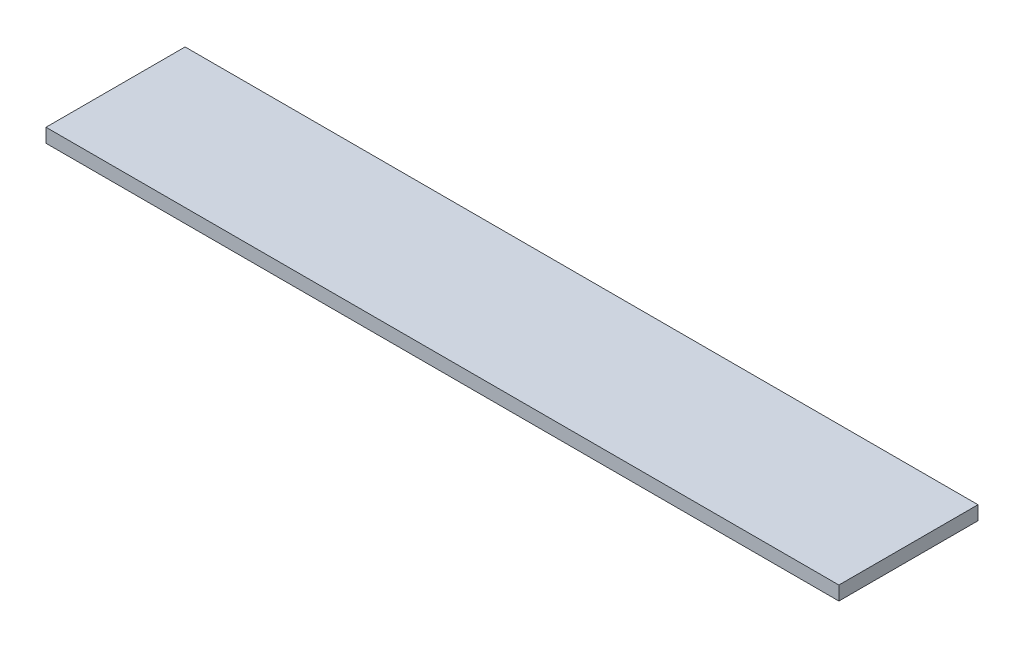
from build123d import *

# Parameters (mm, degrees)
SKETCH1_W             = 57
SKETCH1_H             = 10
BOSS_EXTRUDE1_DEPTH   = 1
BODY_MOVE_COPY1_ANGLE = 90


with BuildPart() as part:
    # Sketch1 → Boss-Extrude1 (new body)
    with BuildSketch(Plane.XY):
        with Locations((-15.811111111, 15.105555556)):
            Rectangle(SKETCH1_W, SKETCH1_H)
    extrude(amount=BOSS_EXTRUDE1_DEPTH)


with BuildPart() as part_1:
    # Body-Move/Copy1: moved
    add(part.part.rotate(Axis((0, 15.105555556, 0.25), (1, 0, 0)), BODY_MOVE_COPY1_ANGLE))


solid = part_1.part
